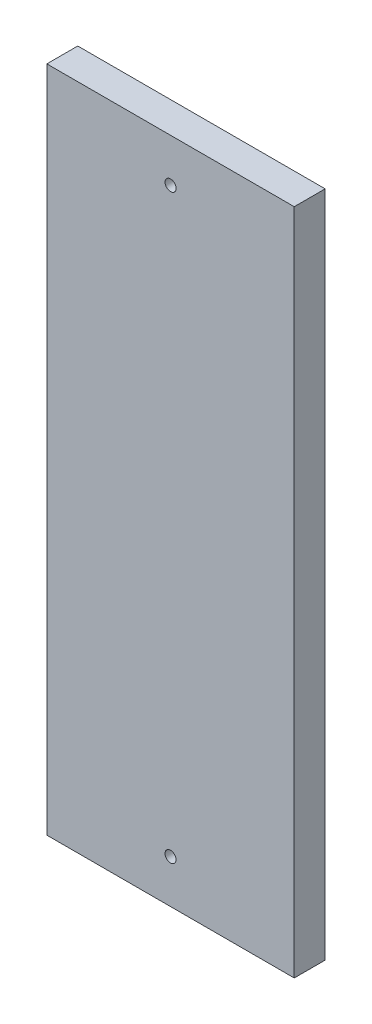
from build123d import *

# Parameters (mm, degrees)
SKETCH1_W           = 50.8
SKETCH1_H           = 6.35
BOSS_EXTRUDE1_DEPTH = 137.16
SKETCH2_R           = 1.1303
CUT_EXTRUDE1_DEPTH  = 140.636485562


with BuildPart() as part:
    # Sketch1 → Boss-Extrude1 (new body)
    with BuildSketch(Plane(origin=(0, 0, 0), x_dir=(1, 0, 0), z_dir=(0, 1, 0))):
        Rectangle(SKETCH1_W, SKETCH1_H)
    extrude(amount=BOSS_EXTRUDE1_DEPTH)

    # Sketch2 → Cut-Extrude1 (cut, through all)
    with BuildSketch(Plane(origin=(0, 0, -3.175), x_dir=(-1, 0, 0), z_dir=(0, 0, -1))):
        with Locations((0, 128.27)):
            Circle(SKETCH2_R)
        with Locations(Location((0, 8.89, 0), (0, 0, 180))):
            Circle(SKETCH2_R)
    extrude(amount=-CUT_EXTRUDE1_DEPTH, mode=Mode.SUBTRACT)


solid = part.part
